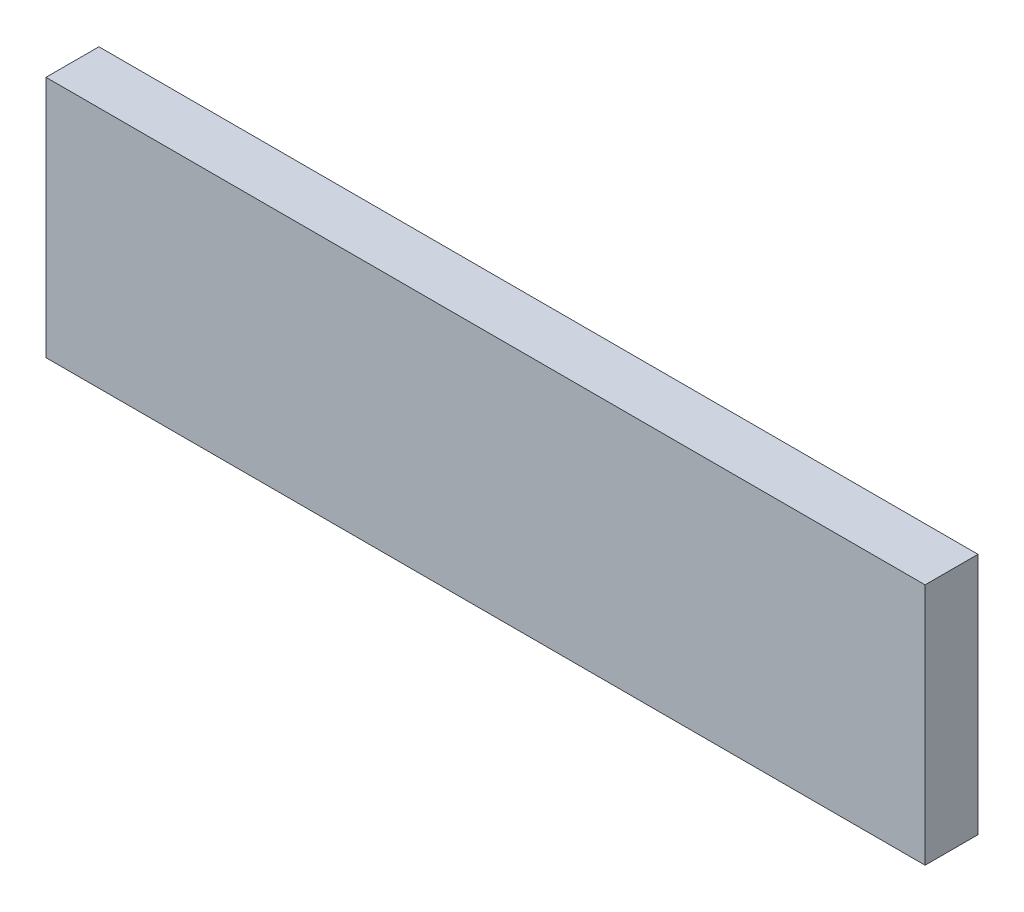
from build123d import *

# Parameters (mm, degrees)
DET2_PU_DILIMI_ARKA_1_START = -758.5
SKETCH1_W                   = 648
SKETCH1_H                   = 179
DET2_PU_DILIMI_ARKA_1_DEPTH = 39


with BuildPart() as part:
    # Sketch1 → DET2_PU_dilimi_arka_1 (new body)
    with BuildSketch(Plane.XY.offset(DET2_PU_DILIMI_ARKA_1_START)):
        with Locations((1026, 1558.5)):
            Rectangle(SKETCH1_W, SKETCH1_H)
    extrude(amount=-DET2_PU_DILIMI_ARKA_1_DEPTH)


solid = part.part
